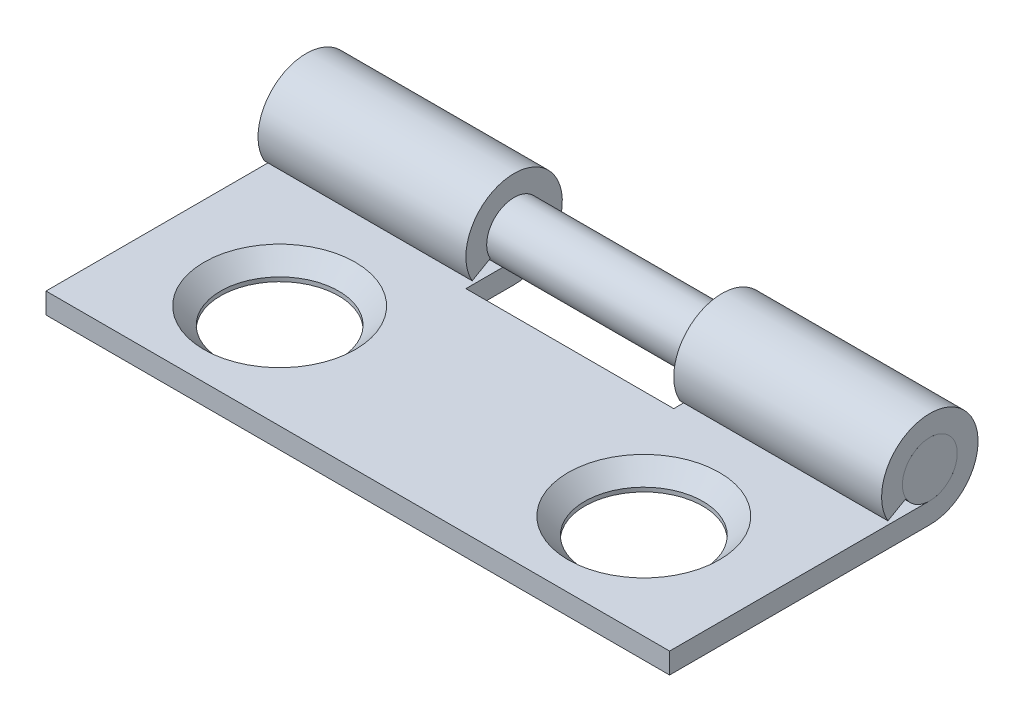
from build123d import *

# Parameters (mm, degrees)
BOSS_EXTRUDE1_DEPTH     = 9.525
CUT_EXTRUDE1_DEPTH      = 13.494063522
CUT_EXTRUDE1_DEPTH_BACK = 13.494063522
SKETCH4_W               = 6.35
SKETCH4_H               = 2.9464
CUT_EXTRUDE3_DEPTH      = 13.494063522
CUT_EXTRUDE3_DEPTH_BACK = 13.494063522
SKETCH9_R               = 1.8034
SKETCH6_R               = 0.8382
BOSS_EXTRUDE2_DEPTH     = 9.525


with BuildPart() as part:
    # Sketch3 → Boss-Extrude1 (new, symmetric)
    with BuildSketch(Plane(origin=(0, 0, 0), x_dir=(0, 0, -1), z_dir=(1, 0, 0))):
        with BuildLine():
            Line((0, -1.4732), (-7.9502, -1.4732))
            Line((-7.9502, -1.4732), (-7.9502, -0.8382))
            Line((-7.9502, -0.8382), (0, -0.8382))
            ThreePointArc((0, -0.8382), (0.421388638, 0.724576328), (-0.728533124, -0.414510226))
            Line((-0.728533124, -0.414510226), (-1.280452157, -0.728533124))
            ThreePointArc((-1.280452157, -0.728533124), (0.740622455, 1.273497789), (0, -1.4732))
        make_face()
    extrude(amount=BOSS_EXTRUDE1_DEPTH, both=True)

    # Sketch4 → Cut-Extrude1 (cut, two sides: drawn at the far end of the back side and taken through both)
    with BuildSketch(Plane(origin=(0, 0, 0), x_dir=(1, 0, 0), z_dir=(0, 1, 0)).offset(-CUT_EXTRUDE1_DEPTH_BACK)):
        Rectangle(SKETCH4_W, SKETCH4_H)
    extrude(amount=CUT_EXTRUDE1_DEPTH + CUT_EXTRUDE1_DEPTH_BACK, mode=Mode.SUBTRACT)

    # Cut-Extrude2 cone 1 section (through the dimple's axis) → Cut-Extrude2 (revolve, cut)
    with BuildSketch(Plane(origin=(5.5626, -0.8382, 4.7752), x_dir=(0, 0, 1), z_dir=(1, 0, 0))):
        Polygon((0, 0), (2.3114, 0), (0, 2.3114), align=None)
    revolve(axis=Axis((5.5626, -0.8382, 4.7752), (0, -1, 0)), mode=Mode.SUBTRACT)

    # Cut-Extrude2 cone 2 section (through the dimple's axis) → Cut-Extrude2 cone 2 (revolve, cut)
    with BuildSketch(Plane(origin=(-5.5626, -0.8382, 4.7752), x_dir=(0, 0, 1), z_dir=(1, 0, 0))):
        Polygon((0, 0), (2.3114, 0), (0, 2.3114), align=None)
    revolve(axis=Axis((-5.5626, -0.8382, 4.7752), (0, -1, 0)), mode=Mode.SUBTRACT)

    # Sketch9 → Cut-Extrude3 (cut, two sides: drawn at the far end of the back side and taken through both)
    with BuildSketch(Plane(origin=(0, 0, 0), x_dir=(1, 0, 0), z_dir=(0, 1, 0)).offset(-CUT_EXTRUDE3_DEPTH_BACK)):
        with Locations(Location((5.5626, -4.7752, 0), (0, 0, 270))):
            Circle(SKETCH9_R)
        with Locations(Location((-5.5626, -4.7752, 0), (0, 0, 270))):
            Circle(SKETCH9_R)
    extrude(amount=CUT_EXTRUDE3_DEPTH + CUT_EXTRUDE3_DEPTH_BACK, mode=Mode.SUBTRACT)


with BuildPart() as body_2:
    # Sketch6 → Boss-Extrude2 (new, symmetric)
    with BuildSketch(Plane(origin=(0, 0, 0), x_dir=(0, 0, -1), z_dir=(1, 0, 0))):
        with Locations(Location((0, 0, 0), (0, 0, 180))):
            Circle(SKETCH6_R)
    extrude(amount=BOSS_EXTRUDE2_DEPTH, both=True)


solid = Compound([part.part, body_2.part])
